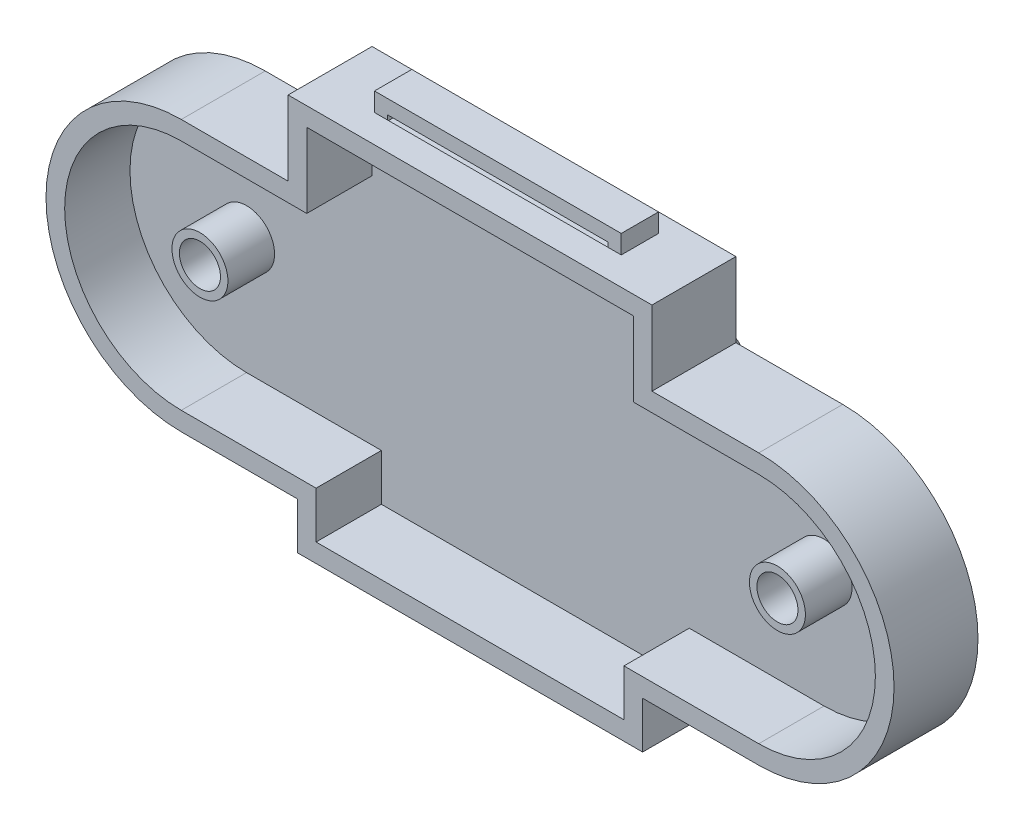
from build123d import *

# Parameters (mm, degrees)
BACK_COVER_DEPTH     = 9
COVER_POCKET_DEPTH   = 7
SK_POSTS_R           = 3
SK_POSTS_R_2         = 2.2
IR_BOARD_POSTS_DEPTH = 5
SK_CAP_W             = 26.45
SK_CAP_H             = 2
CABLE_CAP_DEPTH      = 4
SK_CAPSLOT_W         = 23.64
SK_CAPSLOT_H         = 0.59
RIBBON_SLOT_DEPTH    = 4
SK_FINGER1_R         = 1.6
HINGE_FINGER_1_DEPTH = 1.5
SK_FINGER2_R         = 1.6
HINGE_FINGER_2_DEPTH = 1.5
SK_FINGER3_R         = 1.6
HINGE_FINGER_3_DEPTH = 1.5


with BuildPart() as part:
    # Sk_SkirtOuter → Back Cover (new body)
    with BuildSketch(Plane.XY.offset(-4)):
        with BuildLine():
            Line((29.79, 20), (18.34, 20))
            Line((18.34, 20), (18.34, 28))
            Line((18.34, 28), (-20.66, 28))
            Line((-20.66, 28), (-20.66, 20))
            Line((-20.66, 20), (-32.11, 20))
            ThreePointArc((-32.11, 20), (-46.61, 5.5), (-32.11, -9))
            Line((-32.11, -9), (-19.66, -9))
            Line((-19.66, -9), (-19.66, -14))
            Line((-19.66, -14), (17.34, -14))
            Line((17.34, -14), (17.34, -9))
            Line((17.34, -9), (29.79, -9))
            ThreePointArc((29.79, -9), (44.29, 5.5), (29.79, 20))
        make_face()
    extrude(amount=-BACK_COVER_DEPTH)

    # Sk_SkirtInner → Cover Pocket (cut)
    with BuildSketch(Plane.XY.offset(-4)):
        with BuildLine():
            Line((29.79, 18), (16.34, 18))
            Line((16.34, 18), (16.34, 26))
            Line((16.34, 26), (-18.66, 26))
            Line((-18.66, 26), (-18.66, 18))
            Line((-18.66, 18), (-32.11, 18))
            ThreePointArc((-32.11, 18), (-44.61, 5.5), (-32.11, -7))
            Line((-32.11, -7), (-17.66, -7))
            Line((-17.66, -7), (-17.66, -12))
            Line((-17.66, -12), (15.34, -12))
            Line((15.34, -12), (15.34, -7))
            Line((15.34, -7), (29.79, -7))
            ThreePointArc((29.79, -7), (42.29, 5.5), (29.79, 18))
        make_face()
    extrude(amount=-COVER_POCKET_DEPTH, mode=Mode.SUBTRACT)

    # Sk_Posts → IR Board Posts (add)
    # profile 1 of 2: a face of its own
    with BuildSketch(Plane.XY.offset(-6)):
        with Locations((-32.11, 5.5)):
            Circle(SK_POSTS_R)
        with Locations((-32.11, 5.5)):
            Circle(SK_POSTS_R_2, mode=Mode.SUBTRACT)
    # profile 2 of 2: a face of its own
    with BuildSketch(Plane.XY.offset(-6)):
        with Locations((29.79, 5.5)):
            Circle(SK_POSTS_R)
        with Locations((29.79, 5.5)):
            Circle(SK_POSTS_R_2, mode=Mode.SUBTRACT)
    extrude(amount=-IR_BOARD_POSTS_DEPTH)

    # Sk_Cap → Cable Cap (add)
    with BuildSketch(Plane.XY.offset(-7)):
        with Locations((-1.175, 29)):
            Rectangle(SK_CAP_W, SK_CAP_H)
    extrude(amount=-CABLE_CAP_DEPTH)

    # Sk_CapSlot → Ribbon Slot (cut)
    with BuildSketch(Plane.XY.offset(-7)):
        with Locations((-1.18, 28.195)):
            Rectangle(SK_CAPSLOT_W, SK_CAPSLOT_H)
    extrude(amount=-RIBBON_SLOT_DEPTH, mode=Mode.SUBTRACT)

    # Sk_Finger1 → Hinge Finger 1 (add, symmetric)
    with BuildSketch(Plane(origin=(-7.16, 0, 0), x_dir=(0, 0, -1), z_dir=(1, 0, 0))):
        with BuildLine():
            Line((13, -0.88), (20, -0.88))
            ThreePointArc((20, -0.88), (26, 5.12), (20, 11.12))
            Line((20, 11.12), (13, 11.12))
            Line((13, 11.12), (13, -0.88))
        make_face()
        with Locations((20, 5.12)):
            Circle(SK_FINGER1_R, mode=Mode.SUBTRACT)
    extrude(amount=HINGE_FINGER_1_DEPTH, both=True)

    # Sk_Finger2 → Hinge Finger 2 (add, symmetric)
    with BuildSketch(Plane(origin=(-1.16, 0, 0), x_dir=(0, 0, -1), z_dir=(1, 0, 0))):
        with BuildLine():
            Line((13, -0.88), (20, -0.88))
            ThreePointArc((20, -0.88), (26, 5.12), (20, 11.12))
            Line((20, 11.12), (13, 11.12))
            Line((13, 11.12), (13, -0.88))
        make_face()
        with Locations((20, 5.12)):
            Circle(SK_FINGER2_R, mode=Mode.SUBTRACT)
    extrude(amount=HINGE_FINGER_2_DEPTH, both=True)

    # Sk_Finger3 → Hinge Finger 3 (add, symmetric)
    with BuildSketch(Plane(origin=(4.84, 0, 0), x_dir=(0, 0, -1), z_dir=(1, 0, 0))):
        with BuildLine():
            Line((13, -0.88), (20, -0.88))
            ThreePointArc((20, -0.88), (26, 5.12), (20, 11.12))
            Line((20, 11.12), (13, 11.12))
            Line((13, 11.12), (13, -0.88))
        make_face()
        with Locations((20, 5.12)):
            Circle(SK_FINGER3_R, mode=Mode.SUBTRACT)
    extrude(amount=HINGE_FINGER_3_DEPTH, both=True)


solid = part.part
